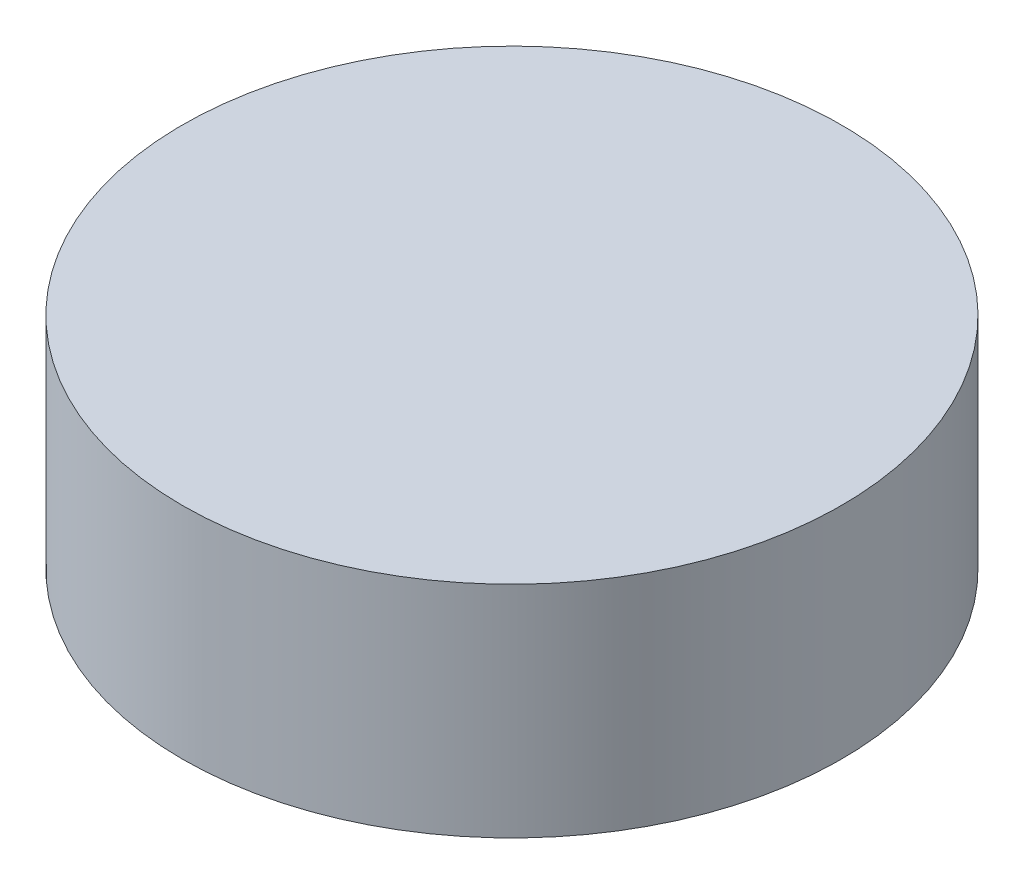
from build123d import *

# Parameters (mm, degrees)
SKETCH1_R           = 45
BOSS_EXTRUDE1_DEPTH = 30


with BuildPart() as part:
    # Sketch1 → Boss-Extrude1 (new body)
    with BuildSketch(Plane(origin=(0, 0, 0), x_dir=(1, 0, 0), z_dir=(0, 1, 0))):
        with Locations(Location((0, 0, 0), (0, 0, 270))):
            Circle(SKETCH1_R)
    extrude(amount=BOSS_EXTRUDE1_DEPTH)


solid = part.part
